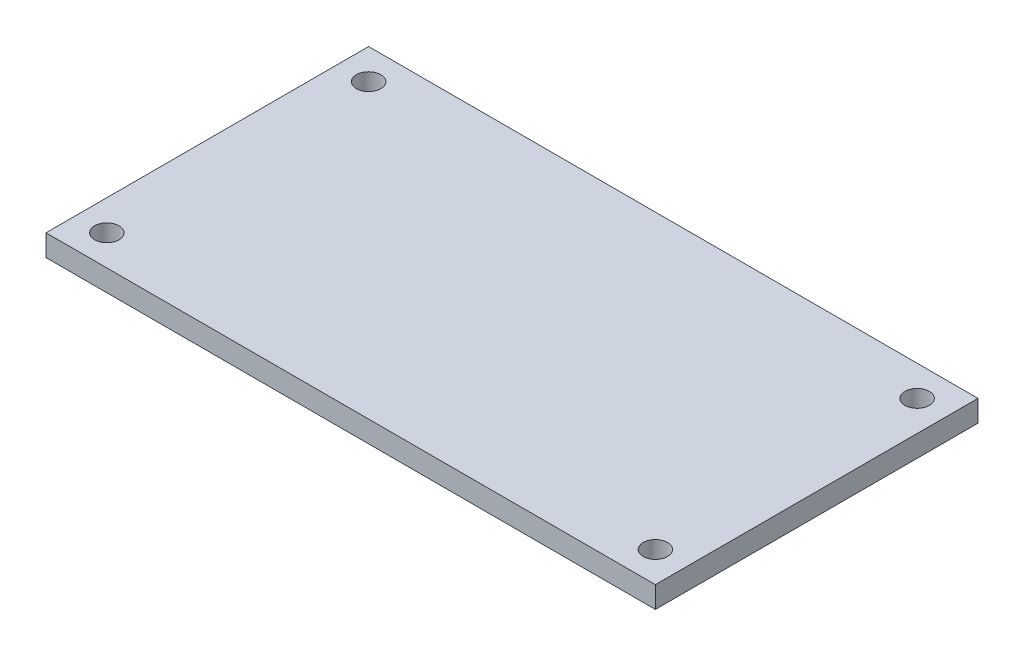
from build123d import *

# Parameters (mm, degrees)
SKETCH1_W           = 85
SKETCH1_H           = 45
SKETCH1_R           = 1.7
BOSS_EXTRUDE1_DEPTH = 3


with BuildPart() as part:
    # Sketch1 → Boss-Extrude1 (new body)
    with BuildSketch(Plane(origin=(0, 0, 0), x_dir=(1, 0, 0), z_dir=(0, 1, 0))):
        with Locations((42.5, 22.5)):
            Rectangle(SKETCH1_W, SKETCH1_H)
        with Locations(Location((4.245, 40.755, 0), (0, 0, 270))):
            Circle(SKETCH1_R, mode=Mode.SUBTRACT)
        with Locations(Location((80.755, 40.755, 0), (0, 0, 270))):
            Circle(SKETCH1_R, mode=Mode.SUBTRACT)
        with Locations(Location((4.245, 4.245, 0), (0, 0, 270))):
            Circle(SKETCH1_R, mode=Mode.SUBTRACT)
        with Locations(Location((80.755, 4.245, 0), (0, 0, 270))):
            Circle(SKETCH1_R, mode=Mode.SUBTRACT)
    extrude(amount=BOSS_EXTRUDE1_DEPTH)


solid = part.part
